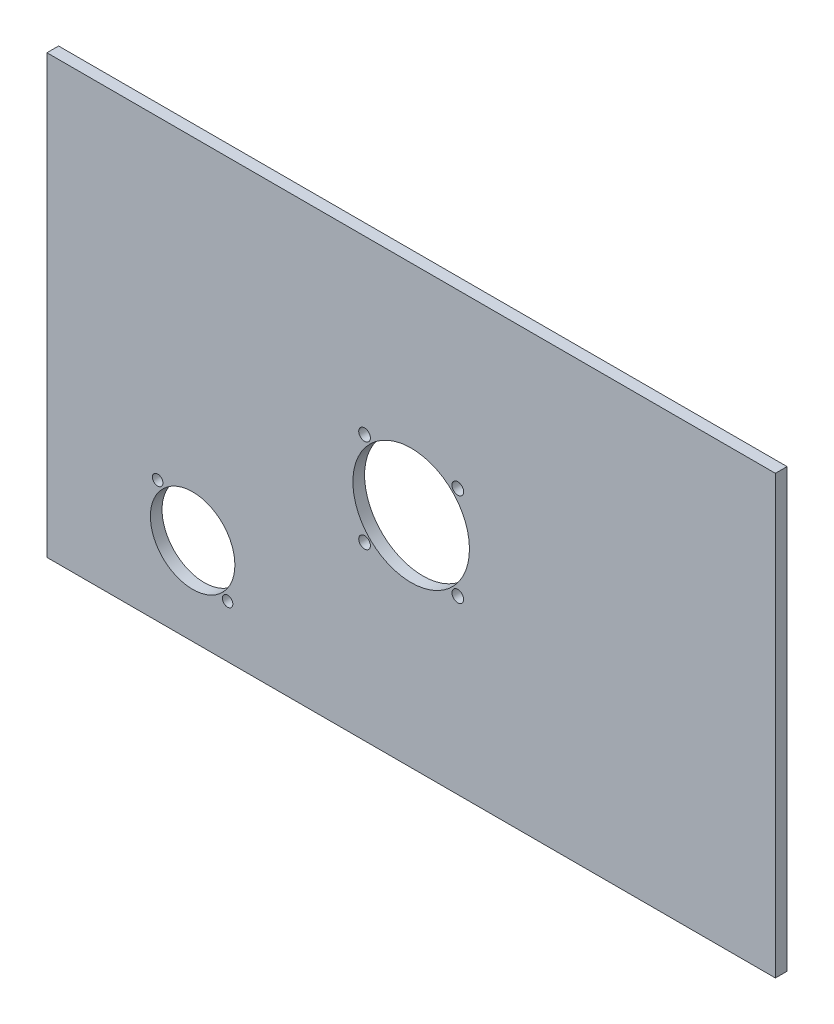
from build123d import *

# Parameters (mm, degrees)
SKETCH1_W           = 250
SKETCH1_H           = 150
BOSS_EXTRUDE1_DEPTH = 4
SKETCH2_R           = 20
CUT_EXTRUDE1_DEPTH  = 4
SKETCH3_R           = 2
CUT_EXTRUDE2_DEPTH  = 4
SKETCH4_R           = 14.5
SKETCH4_R_2         = 1.8
CUT_EXTRUDE4_DEPTH  = 4


with BuildPart() as part:
    # Sketch1 → Boss-Extrude1 (new body)
    with BuildSketch(Plane.XY):
        with Locations((12.175324675, -10.633116883)):
            Rectangle(SKETCH1_W, SKETCH1_H)
    extrude(amount=BOSS_EXTRUDE1_DEPTH)

    # Sketch2 → Cut-Extrude1 (cut)
    with BuildSketch(Plane.XY.offset(4)):
        with Locations((12.175324675, -10.633116883)):
            Circle(SKETCH2_R)
    extrude(amount=-CUT_EXTRUDE1_DEPTH, mode=Mode.SUBTRACT)

    # Sketch3 → Cut-Extrude2 (cut)
    with BuildSketch(Plane.XY.offset(4)):
        with Locations((-3.824675325, 5.366883117)):
            Circle(SKETCH3_R)
        with Locations((28.175324675, 5.366883117)):
            Circle(SKETCH3_R)
        with Locations((28.175324675, -26.633116883)):
            Circle(SKETCH3_R)
        with Locations((-3.824675325, -26.633116883)):
            Circle(SKETCH3_R)
    extrude(amount=-CUT_EXTRUDE2_DEPTH, mode=Mode.SUBTRACT)

    # Sketch4 → Cut-Extrude4 (cut)
    with BuildSketch(Plane.XY.offset(4)):
        with Locations((-62.824675325, -55.633116883)):
            Circle(SKETCH4_R)
        with Locations((-74.824675325, -43.633116883)):
            Circle(SKETCH4_R_2)
        with Locations((-50.824675325, -67.633116883)):
            Circle(SKETCH4_R_2)
    extrude(amount=-CUT_EXTRUDE4_DEPTH, mode=Mode.SUBTRACT)


solid = part.part
